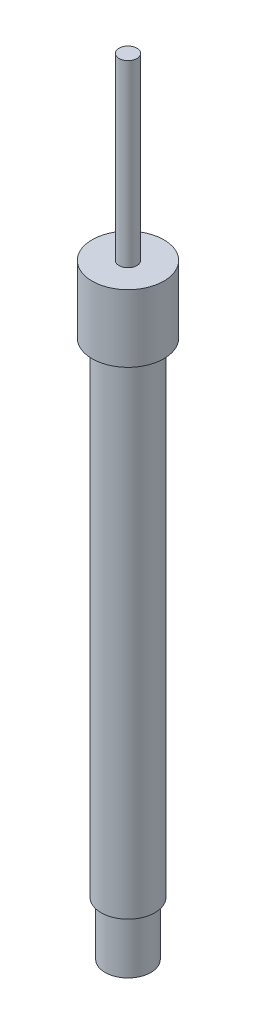
from build123d import *

# Parameters (mm, degrees)
SKETCH1_R       = 5.1
GLASS_TIP_DEPTH = 12
BODY_START      = 12
SKETCH2_R       = 6
BODY_DEPTH      = 108
CAP_START       = 120
SKETCH3_R       = 8
CAP_DEPTH       = 15
CABLE_START     = 135
SKETCH4_R       = 2
CABLE_DEPTH     = 40


with BuildPart() as part:
    # Sketch1 → Glass_Tip (new body)
    with BuildSketch(Plane(origin=(0, 0, 0), x_dir=(1, 0, 0), z_dir=(0, 1, 0))):
        with Locations(Location((0, 0, 0), (0, 0, 270))):
            Circle(SKETCH1_R)
    extrude(amount=GLASS_TIP_DEPTH)

    # Sketch2 → Body (add)
    with BuildSketch(Plane(origin=(0, 0, 0), x_dir=(1, 0, 0), z_dir=(0, 1, 0)).offset(BODY_START)):
        with Locations(Location((0, 0, 0), (0, 0, 270))):
            Circle(SKETCH2_R)
    extrude(amount=BODY_DEPTH)

    # Sketch3 → Cap (add)
    with BuildSketch(Plane(origin=(0, 0, 0), x_dir=(1, 0, 0), z_dir=(0, 1, 0)).offset(CAP_START)):
        with Locations(Location((0, 0, 0), (0, 0, 270))):
            Circle(SKETCH3_R)
    extrude(amount=CAP_DEPTH)

    # Sketch4 → Cable (add)
    with BuildSketch(Plane(origin=(0, 0, 0), x_dir=(1, 0, 0), z_dir=(0, 1, 0)).offset(CABLE_START)):
        with Locations(Location((0, 0, 0), (0, 0, 270))):
            Circle(SKETCH4_R)
    extrude(amount=CABLE_DEPTH)


solid = part.part
